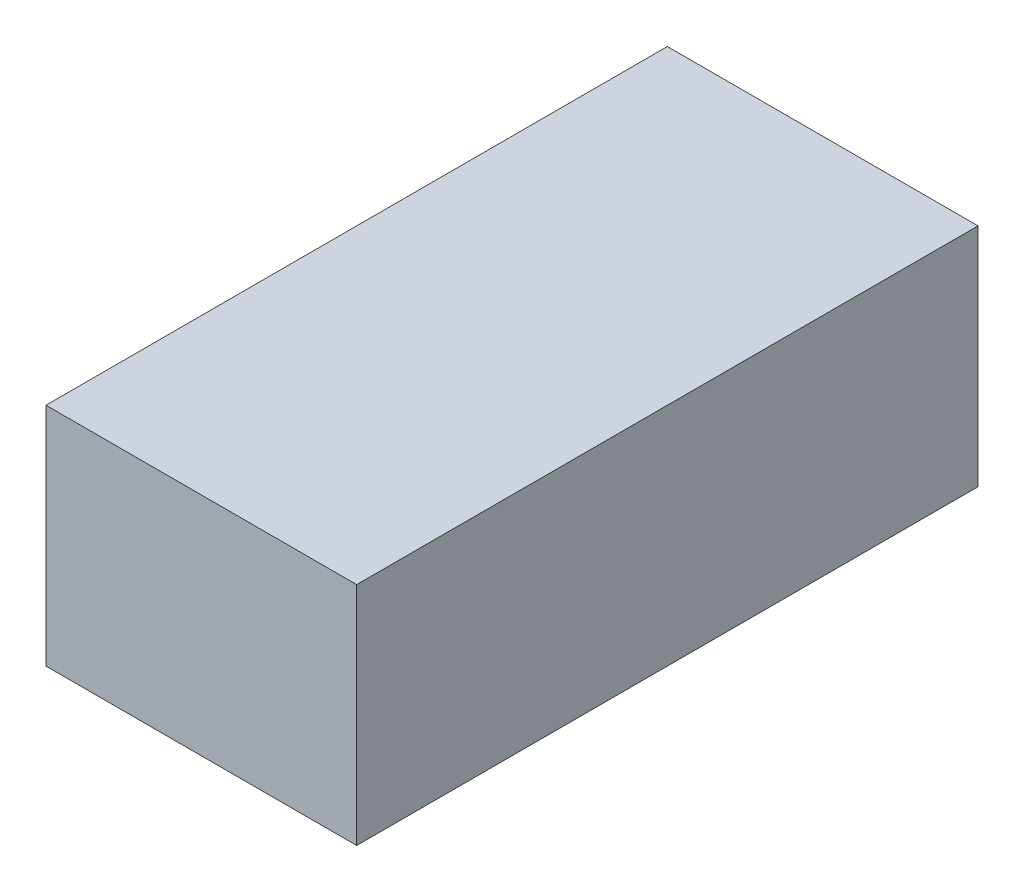
from build123d import *

# Parameters (mm, degrees)
SKETCH_1_W      = 55
SKETCH_1_H      = 110
EXTRUDE_1_DEPTH = 40


with BuildPart() as part:
    # 草图1 → 凸台-拉伸1 (new body)
    with BuildSketch(Plane(origin=(0, 0, 0), x_dir=(1, 0, 0), z_dir=(0, 1, 0))):
        Rectangle(SKETCH_1_W, SKETCH_1_H)
    extrude(amount=EXTRUDE_1_DEPTH)


solid = part.part
